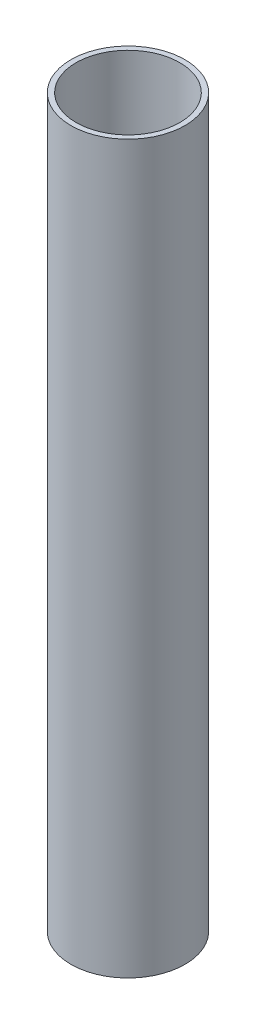
from build123d import *

# Parameters (mm, degrees)
SKETCH1_R           = 55
SKETCH1_R_2         = 50
BOSS_EXTRUDE1_DEPTH = 700


with BuildPart() as part:
    # Sketch1 → Boss-Extrude1 (new body)
    with BuildSketch(Plane(origin=(0, 0, 0), x_dir=(1, 0, 0), z_dir=(0, 1, 0))):
        with Locations(Location((0, 0, 0), (0, 0, 270))):
            Circle(SKETCH1_R)
        with Locations(Location((0, 0, 0), (0, 0, 270))):
            Circle(SKETCH1_R_2, mode=Mode.SUBTRACT)
    extrude(amount=BOSS_EXTRUDE1_DEPTH)


solid = part.part
